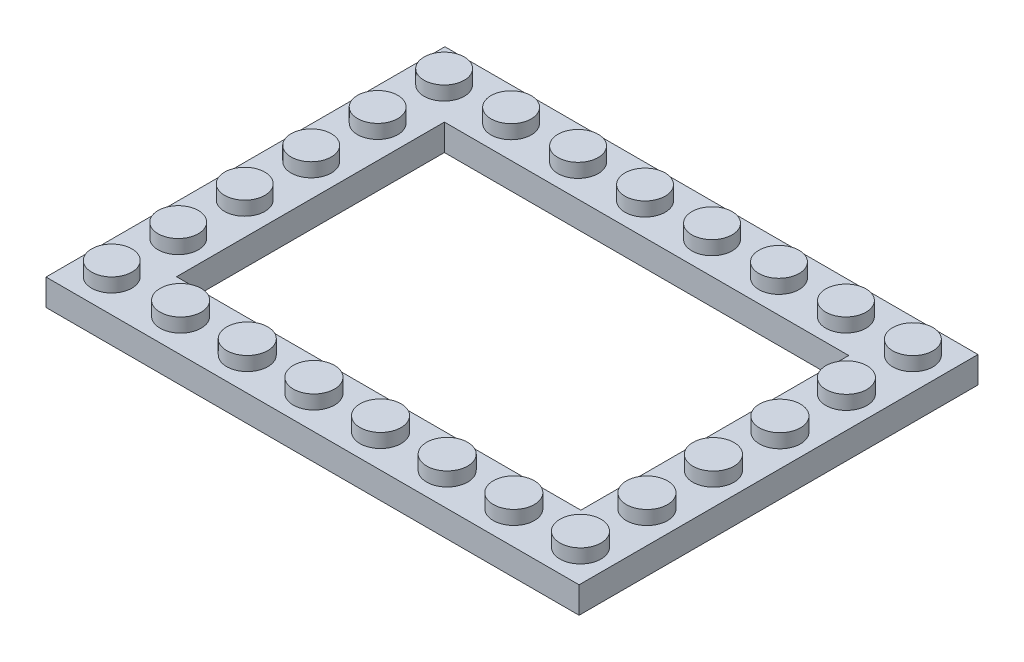
from build123d import *

# Parameters (mm, degrees)
SKETCH1_W           = 63.8
SKETCH1_H           = 3.16
BOSS_EXTRUDE1_DEPTH = 47.74
SKETCH2_W           = 48.39
SKETCH2_H           = 32.06
CUT_EXTRUDE1_DEPTH  = 80.746681436
SKETCH3_R           = 2.41
SKETCH3_R_2         = 2.46
BOSS_EXTRUDE2_DEPTH = 1.67
SHELL1_T            = -1.68
SKETCH4_R           = 1.485
SKETCH4_R_2         = 1.04
BOSS_EXTRUDE3_DEPTH = 1.23


with BuildPart() as part:
    # Sketch1 → Boss-Extrude1 (new body)
    with BuildSketch(Plane.XY):
        with Locations((31.9, 1.58)):
            Rectangle(SKETCH1_W, SKETCH1_H)
    extrude(amount=-BOSS_EXTRUDE1_DEPTH)

    # Sketch2 → Cut-Extrude1 (cut, through all)
    with BuildSketch(Plane(origin=(0, 3.16, 0), x_dir=(1, 0, 0), z_dir=(0, 1, 0))):
        with Locations((31.975, 23.87)):
            Rectangle(SKETCH2_W, SKETCH2_H)
    extrude(amount=-CUT_EXTRUDE1_DEPTH, mode=Mode.SUBTRACT)

    # Sketch3 → Boss-Extrude2 (add)
    with BuildSketch(Plane(origin=(0, 3.16, 0), x_dir=(1, 0, 0), z_dir=(0, 1, 0))):
        with Locations(Location((3.89, 43.761666667, 0), (0, 0, 180))):
            Circle(SKETCH3_R)
        with Locations(Location((11.903571429, 43.761666667, 0), (0, 0, 180))):
            Circle(SKETCH3_R)
        with Locations(Location((19.917142857, 43.761666667, 0), (0, 0, 180))):
            Circle(SKETCH3_R)
        with Locations(Location((27.930714286, 43.761666667, 0), (0, 0, 180))):
            Circle(SKETCH3_R)
        with Locations(Location((35.944285714, 43.761666667, 0), (0, 0, 180))):
            Circle(SKETCH3_R)
        with Locations(Location((43.957857143, 43.761666667, 0), (0, 0, 180))):
            Circle(SKETCH3_R)
        with Locations(Location((51.971428571, 43.761666667, 0), (0, 0, 180))):
            Circle(SKETCH3_R)
        with Locations(Location((59.985, 43.761666667, 0), (0, 0, 180))):
            Circle(SKETCH3_R)
        with Locations(Location((3.89, 35.805, 0), (0, 0, 180))):
            Circle(SKETCH3_R)
        with Locations(Location((3.89, 27.848333333, 0), (0, 0, 180))):
            Circle(SKETCH3_R)
        with Locations(Location((3.89, 19.891666667, 0), (0, 0, 180))):
            Circle(SKETCH3_R)
        with Locations(Location((3.89, 11.935, 0), (0, 0, 180))):
            Circle(SKETCH3_R)
        with Locations(Location((3.89, 3.978333333, 0), (0, 0, 180))):
            Circle(SKETCH3_R)
        with Locations(Location((59.985, 3.978333333, 0), (0, 0, 180))):
            Circle(SKETCH3_R_2)
        with Locations(Location((59.985, 11.935, 0), (0, 0, 180))):
            Circle(SKETCH3_R_2)
        with Locations(Location((59.985, 19.891666667, 0), (0, 0, 180))):
            Circle(SKETCH3_R_2)
        with Locations(Location((59.985, 27.848333333, 0), (0, 0, 180))):
            Circle(SKETCH3_R_2)
        with Locations(Location((59.985, 35.805, 0), (0, 0, 180))):
            Circle(SKETCH3_R_2)
        with Locations(Location((52.01, 3.978333333, 0), (0, 0, 180))):
            Circle(SKETCH3_R_2)
        with Locations(Location((44.035, 3.978333333, 0), (0, 0, 180))):
            Circle(SKETCH3_R_2)
        with Locations(Location((36.06, 3.978333333, 0), (0, 0, 180))):
            Circle(SKETCH3_R_2)
        with Locations(Location((28.085, 3.978333333, 0), (0, 0, 180))):
            Circle(SKETCH3_R_2)
        with Locations(Location((20.11, 3.978333333, 0), (0, 0, 180))):
            Circle(SKETCH3_R_2)
        with Locations(Location((12.135, 3.978333333, 0), (0, 0, 180))):
            Circle(SKETCH3_R_2)
    extrude(amount=BOSS_EXTRUDE2_DEPTH)

    # Shell1
    shell1_openings = [part.faces().sort_by_distance(p)[0] for p in [
        (0.796840486, 0, -23.87),
    ]]
    offset(amount=SHELL1_T, openings=shell1_openings, kind=Kind.INTERSECTION)

    # Sketch4 → Boss-Extrude3 (add)
    # profile 1 of 24: a face of its own
    with BuildSketch(Plane.XZ.offset(-1.48)):
        with Locations(Location((7.88, -3.92, 0), (0, 0, 180))):
            Circle(SKETCH4_R)
        with Locations((7.88, -3.92)):
            Circle(SKETCH4_R_2, mode=Mode.SUBTRACT)
    # profile 2 of 24: a face of its own
    with BuildSketch(Plane.XZ.offset(-1.48)):
        with Locations(Location((3.89, -31.835, 0), (0, 0, 180))):
            Circle(SKETCH4_R)
        with Locations((3.89, -31.835)):
            Circle(SKETCH4_R_2, mode=Mode.SUBTRACT)
    # profile 3 of 24: a face of its own
    with BuildSketch(Plane.XZ.offset(-1.48)):
        with Locations(Location((15.86, -3.92, 0), (0, 0, 180))):
            Circle(SKETCH4_R)
        with Locations((15.86, -3.92)):
            Circle(SKETCH4_R_2, mode=Mode.SUBTRACT)
    # profile 4 of 24: a face of its own
    with BuildSketch(Plane.XZ.offset(-1.48)):
        with Locations(Location((23.84, -3.92, 0), (0, 0, 180))):
            Circle(SKETCH4_R)
        with Locations((23.84, -3.92)):
            Circle(SKETCH4_R_2, mode=Mode.SUBTRACT)
    # profile 5 of 24: a face of its own
    with BuildSketch(Plane.XZ.offset(-1.48)):
        with Locations(Location((31.82, -3.92, 0), (0, 0, 180))):
            Circle(SKETCH4_R)
        with Locations((31.82, -3.92)):
            Circle(SKETCH4_R_2, mode=Mode.SUBTRACT)
    # profile 6 of 24: a face of its own
    with BuildSketch(Plane.XZ.offset(-1.48)):
        with Locations(Location((39.8, -3.92, 0), (0, 0, 180))):
            Circle(SKETCH4_R)
        with Locations((39.8, -3.92)):
            Circle(SKETCH4_R_2, mode=Mode.SUBTRACT)
    # profile 7 of 24: a face of its own
    with BuildSketch(Plane.XZ.offset(-1.48)):
        with Locations(Location((47.78, -3.92, 0), (0, 0, 180))):
            Circle(SKETCH4_R)
        with Locations((47.78, -3.92)):
            Circle(SKETCH4_R_2, mode=Mode.SUBTRACT)
    # profile 8 of 24: a face of its own
    with BuildSketch(Plane.XZ.offset(-1.48)):
        with Locations(Location((55.76, -3.92, 0), (0, 0, 180))):
            Circle(SKETCH4_R)
        with Locations((55.76, -3.92)):
            Circle(SKETCH4_R_2, mode=Mode.SUBTRACT)
    # profile 9 of 24: a face of its own
    with BuildSketch(Plane.XZ.offset(-1.48)):
        with Locations(Location((3.89, -23.875, 0), (0, 0, 180))):
            Circle(SKETCH4_R)
        with Locations((3.89, -23.875)):
            Circle(SKETCH4_R_2, mode=Mode.SUBTRACT)
    # profile 10 of 24: a face of its own
    with BuildSketch(Plane.XZ.offset(-1.48)):
        with Locations(Location((7.918571429, -43.82, 0), (0, 0, 180))):
            Circle(SKETCH4_R)
        with Locations((7.918571429, -43.82)):
            Circle(SKETCH4_R_2, mode=Mode.SUBTRACT)
    # profile 11 of 24: a face of its own
    with BuildSketch(Plane.XZ.offset(-1.48)):
        with Locations(Location((15.898571429, -43.82, 0), (0, 0, 180))):
            Circle(SKETCH4_R)
        with Locations((15.898571429, -43.82)):
            Circle(SKETCH4_R_2, mode=Mode.SUBTRACT)
    # profile 12 of 24: a face of its own
    with BuildSketch(Plane.XZ.offset(-1.48)):
        with Locations(Location((23.878571429, -43.82, 0), (0, 0, 180))):
            Circle(SKETCH4_R)
        with Locations((23.878571429, -43.82)):
            Circle(SKETCH4_R_2, mode=Mode.SUBTRACT)
    # profile 13 of 24: a face of its own
    with BuildSketch(Plane.XZ.offset(-1.48)):
        with Locations(Location((31.858571429, -43.82, 0), (0, 0, 180))):
            Circle(SKETCH4_R)
        with Locations((31.858571429, -43.82)):
            Circle(SKETCH4_R_2, mode=Mode.SUBTRACT)
    # profile 14 of 24: a face of its own
    with BuildSketch(Plane.XZ.offset(-1.48)):
        with Locations(Location((39.838571429, -43.82, 0), (0, 0, 180))):
            Circle(SKETCH4_R)
        with Locations((39.838571429, -43.82)):
            Circle(SKETCH4_R_2, mode=Mode.SUBTRACT)
    # profile 15 of 24: a face of its own
    with BuildSketch(Plane.XZ.offset(-1.48)):
        with Locations(Location((47.818571429, -43.82, 0), (0, 0, 180))):
            Circle(SKETCH4_R)
        with Locations((47.818571429, -43.82)):
            Circle(SKETCH4_R_2, mode=Mode.SUBTRACT)
    # profile 16 of 24: a face of its own
    with BuildSketch(Plane.XZ.offset(-1.48)):
        with Locations(Location((55.798571429, -43.82, 0), (0, 0, 180))):
            Circle(SKETCH4_R)
        with Locations((55.798571429, -43.82)):
            Circle(SKETCH4_R_2, mode=Mode.SUBTRACT)
    # profile 17 of 24: a face of its own
    with BuildSketch(Plane.XZ.offset(-1.48)):
        with Locations(Location((59.985, -39.781666667, 0), (0, 0, 180))):
            Circle(SKETCH4_R)
        with Locations((59.985, -39.781666667)):
            Circle(SKETCH4_R_2, mode=Mode.SUBTRACT)
    # profile 18 of 24: a face of its own
    with BuildSketch(Plane.XZ.offset(-1.48)):
        with Locations(Location((59.985, -31.821666667, 0), (0, 0, 180))):
            Circle(SKETCH4_R)
        with Locations((59.985, -31.821666667)):
            Circle(SKETCH4_R_2, mode=Mode.SUBTRACT)
    # profile 19 of 24: a face of its own
    with BuildSketch(Plane.XZ.offset(-1.48)):
        with Locations(Location((59.985, -23.861666667, 0), (0, 0, 180))):
            Circle(SKETCH4_R)
        with Locations((59.985, -23.861666667)):
            Circle(SKETCH4_R_2, mode=Mode.SUBTRACT)
    # profile 20 of 24: a face of its own
    with BuildSketch(Plane.XZ.offset(-1.48)):
        with Locations(Location((59.985, -15.901666667, 0), (0, 0, 180))):
            Circle(SKETCH4_R)
        with Locations((59.985, -15.901666667)):
            Circle(SKETCH4_R_2, mode=Mode.SUBTRACT)
    # profile 21 of 24: a face of its own
    with BuildSketch(Plane.XZ.offset(-1.48)):
        with Locations(Location((59.985, -7.941666667, 0), (0, 0, 180))):
            Circle(SKETCH4_R)
        with Locations((59.985, -7.941666667)):
            Circle(SKETCH4_R_2, mode=Mode.SUBTRACT)
    # profile 22 of 24: a face of its own
    with BuildSketch(Plane.XZ.offset(-1.48)):
        with Locations(Location((3.89, -39.795, 0), (0, 0, 180))):
            Circle(SKETCH4_R)
        with Locations((3.89, -39.795)):
            Circle(SKETCH4_R_2, mode=Mode.SUBTRACT)
    # profile 23 of 24: a face of its own
    with BuildSketch(Plane.XZ.offset(-1.48)):
        with Locations(Location((3.89, -15.915, 0), (0, 0, 180))):
            Circle(SKETCH4_R)
        with Locations((3.89, -15.915)):
            Circle(SKETCH4_R_2, mode=Mode.SUBTRACT)
    # profile 24 of 24: a face of its own
    with BuildSketch(Plane.XZ.offset(-1.48)):
        with Locations(Location((3.89, -7.955, 0), (0, 0, 180))):
            Circle(SKETCH4_R)
        with Locations((3.89, -7.955)):
            Circle(SKETCH4_R_2, mode=Mode.SUBTRACT)
    extrude(amount=BOSS_EXTRUDE3_DEPTH)


solid = part.part
